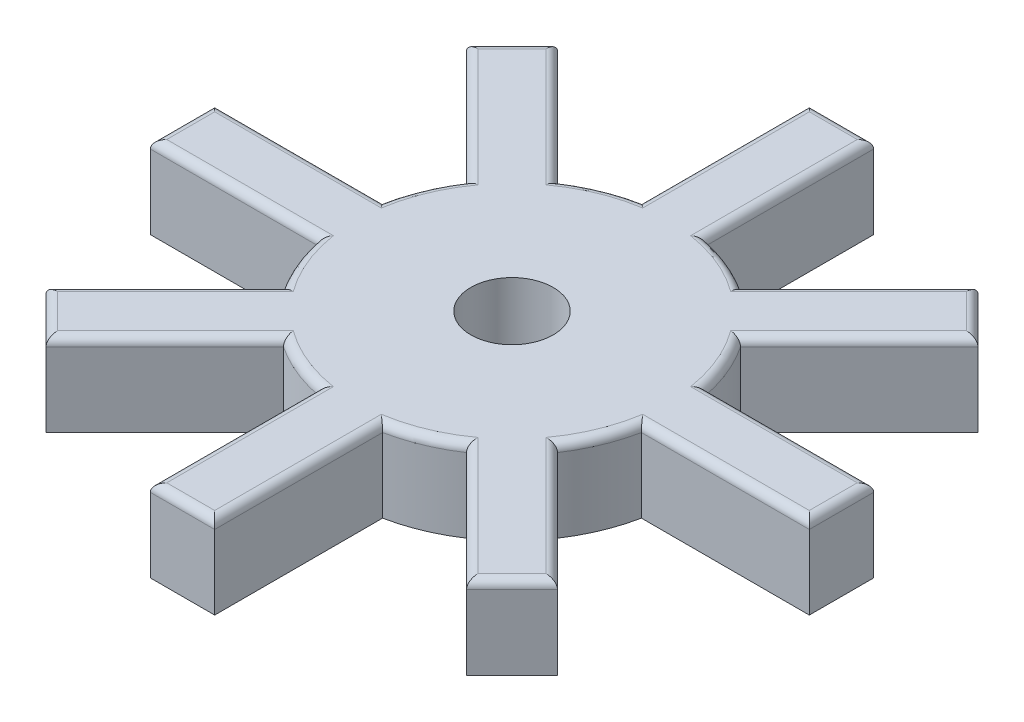
from build123d import *

# Parameters (mm, degrees)
EXTRUDE_1_DEPTH = 5
FILLET_1_R      = 0.5


with BuildPart() as part:
    # 草图1 → 凸台-拉伸1 (new body)
    with BuildSketch(Plane(origin=(0, 0, 0), x_dir=(1, 0, 0), z_dir=(0, 1, 0))):
        with BuildLine():
            ThreePointArc((-8.316516862, 5.552976435), (-7.071067812, 7.071067812), (-5.552976435, 8.316516862))
            Line((-5.552976435, 8.316516862), (-12.76036541, 15.523905838))
            Line((-12.76036541, 15.523905838), (-15.523905838, 12.76036541))
            Line((-15.523905838, 12.76036541), (-8.316516862, 5.552976435))
        make_face()
        with BuildLine():
            Line((-20, -1.954118176), (-9.807212762, -1.954118176))
            ThreePointArc((-9.807212762, -1.954118176), (-10, 0), (-9.807212762, 1.954118176))
            Line((-9.807212762, 1.954118176), (-20, 1.954118176))
            Line((-20, 1.954118176), (-20, -1.954118176))
        make_face()
        with BuildLine():
            Line((-12.76036541, -15.523905838), (-5.552976435, -8.316516862))
            ThreePointArc((-5.552976435, -8.316516862), (-7.071067812, -7.071067812), (-8.316516862, -5.552976435))
            Line((-8.316516862, -5.552976435), (-15.523905838, -12.76036541))
            Line((-15.523905838, -12.76036541), (-12.76036541, -15.523905838))
        make_face()
        with BuildLine():
            ThreePointArc((-1.954118176, -9.807212762), (-0.981802522, -9.951686481), (0, -10))
            Line((0, -10), (0, -2.5))
            ThreePointArc((0, -2.5), (-2.5, 0), (0, 2.5))
            Line((0, 2.5), (0, 10))
            ThreePointArc((0, 10), (-0.981802522, 9.951686481), (-1.954118176, 9.807212762))
            ThreePointArc((-1.954118176, 9.807212762), (-3.826834324, 9.238795325), (-5.552976435, 8.316516862))
            ThreePointArc((-5.552976435, 8.316516862), (-7.071067812, 7.071067812), (-8.316516862, 5.552976435))
            ThreePointArc((-8.316516862, 5.552976435), (-9.238795325, 3.826834324), (-9.807212762, 1.954118176))
            ThreePointArc((-9.807212762, 1.954118176), (-10, 0), (-9.807212762, -1.954118176))
            ThreePointArc((-9.807212762, -1.954118176), (-9.238795325, -3.826834324), (-8.316516862, -5.552976435))
            ThreePointArc((-8.316516862, -5.552976435), (-7.071067812, -7.071067812), (-5.552976435, -8.316516862))
            ThreePointArc((-5.552976435, -8.316516862), (-3.826834324, -9.238795325), (-1.954118176, -9.807212762))
        make_face()
        with BuildLine():
            Line((0, -2.5), (0, -10))
            ThreePointArc((0, -10), (0.981802522, -9.951686481), (1.954118176, -9.807212762))
            ThreePointArc((1.954118176, -9.807212762), (3.826834324, -9.238795325), (5.552976435, -8.316516862))
            ThreePointArc((5.552976435, -8.316516862), (7.071067812, -7.071067812), (8.316516862, -5.552976435))
            ThreePointArc((8.316516862, -5.552976435), (9.238795325, -3.826834324), (9.807212762, -1.954118176))
            ThreePointArc((9.807212762, -1.954118176), (9.951686481, -0.981802522), (10, 0))
            ThreePointArc((10, 0), (9.951686481, 0.981802522), (9.807212762, 1.954118176))
            ThreePointArc((9.807212762, 1.954118176), (9.238795325, 3.826834324), (8.316516862, 5.552976435))
            ThreePointArc((8.316516862, 5.552976435), (7.071067812, 7.071067812), (5.552976435, 8.316516862))
            ThreePointArc((5.552976435, 8.316516862), (3.826834324, 9.238795325), (1.954118176, 9.807212762))
            ThreePointArc((1.954118176, 9.807212762), (0.981802522, 9.951686481), (0, 10))
            Line((0, 10), (0, 2.5))
            ThreePointArc((0, 2.5), (1.767766953, 1.767766953), (2.5, 0))
            ThreePointArc((2.5, 0), (1.767766953, -1.767766953), (0, -2.5))
        make_face()
        with BuildLine():
            Line((0, 20), (0, 10))
            ThreePointArc((0, 10), (0.981802522, 9.951686481), (1.954118176, 9.807212762))
            Line((1.954118176, 9.807212762), (1.954118176, 20))
            Line((1.954118176, 20), (0, 20))
        make_face()
        with BuildLine():
            ThreePointArc((-1.954118176, 9.807212762), (-0.981802522, 9.951686481), (0, 10))
            Line((0, 10), (0, 20))
            Line((0, 20), (-1.954118176, 20))
            Line((-1.954118176, 20), (-1.954118176, 9.807212762))
        make_face()
        with BuildLine():
            Line((12.76036541, 15.523905838), (5.552976435, 8.316516862))
            ThreePointArc((5.552976435, 8.316516862), (7.071067812, 7.071067812), (8.316516862, 5.552976435))
            Line((8.316516862, 5.552976435), (15.523905838, 12.76036541))
            Line((15.523905838, 12.76036541), (12.76036541, 15.523905838))
        make_face()
        with BuildLine():
            ThreePointArc((10, 0), (9.951686481, -0.981802522), (9.807212762, -1.954118176))
            Line((9.807212762, -1.954118176), (20, -1.954118176))
            Line((20, -1.954118176), (20, 1.954118176))
            Line((20, 1.954118176), (9.807212762, 1.954118176))
            ThreePointArc((9.807212762, 1.954118176), (9.951686481, 0.981802522), (10, 0))
        make_face()
        with BuildLine():
            ThreePointArc((8.316516862, -5.552976435), (7.071067812, -7.071067812), (5.552976435, -8.316516862))
            Line((5.552976435, -8.316516862), (12.76036541, -15.523905838))
            Line((12.76036541, -15.523905838), (15.523905838, -12.76036541))
            Line((15.523905838, -12.76036541), (8.316516862, -5.552976435))
        make_face()
        with BuildLine():
            Line((-1.954118176, -20), (0, -20))
            Line((0, -20), (0, -10))
            ThreePointArc((0, -10), (-0.981802522, -9.951686481), (-1.954118176, -9.807212762))
            Line((-1.954118176, -9.807212762), (-1.954118176, -20))
        make_face()
        with BuildLine():
            Line((0, -10), (0, -20))
            Line((0, -20), (1.954118176, -20))
            Line((1.954118176, -20), (1.954118176, -9.807212762))
            ThreePointArc((1.954118176, -9.807212762), (0.981802522, -9.951686481), (0, -10))
        make_face()
    extrude(amount=EXTRUDE_1_DEPTH)

    # 圆角1
    fillet_1_edges = [part.edges().sort_by_distance(p)[0] for p in [
        (9.156670922, 5, 11.92021135),
        (14.142135624, 5, 14.142135624),
        (0, 5, -20),
        (11.92021135, 5, 9.156670922),
        (9.238795325, 5, 3.826834324),
        (14.903606381, 5, 1.954118176),
        (20, 5, 0),
        (14.903606381, 5, -1.954118176),
        (9.238795325, 5, -3.826834324),
        (11.92021135, 5, -9.156670922),
        (14.142135624, 5, -14.142135624),
        (9.156670922, 5, -11.92021135),
        (3.826834324, 5, -9.238795325),
        (-1.954118176, 5, -14.903606381),
        (-3.826834324, 5, -9.238795325),
        (-9.156670922, 5, -11.92021135),
        (-14.142135624, 5, -14.142135624),
        (-11.92021135, 5, -9.156670922),
        (-9.238795325, 5, -3.826834324),
        (-14.903606381, 5, -1.954118176),
        (-20, 5, 0),
        (-14.903606381, 5, 1.954118176),
        (1.954118176, 5, -14.903606381),
        (-9.238795325, 5, 3.826834324),
        (-11.92021135, 5, 9.156670922),
        (-14.142135624, 5, 14.142135624),
        (-9.156670922, 5, 11.92021135),
        (-3.826834324, 5, 9.238795325),
        (-1.954118176, 5, 14.903606381),
        (0, 5, 20),
        (1.954118176, 5, 14.903606381),
        (3.826834324, 5, 9.238795325),
    ]]
    fillet(fillet_1_edges, radius=FILLET_1_R)


solid = part.part
